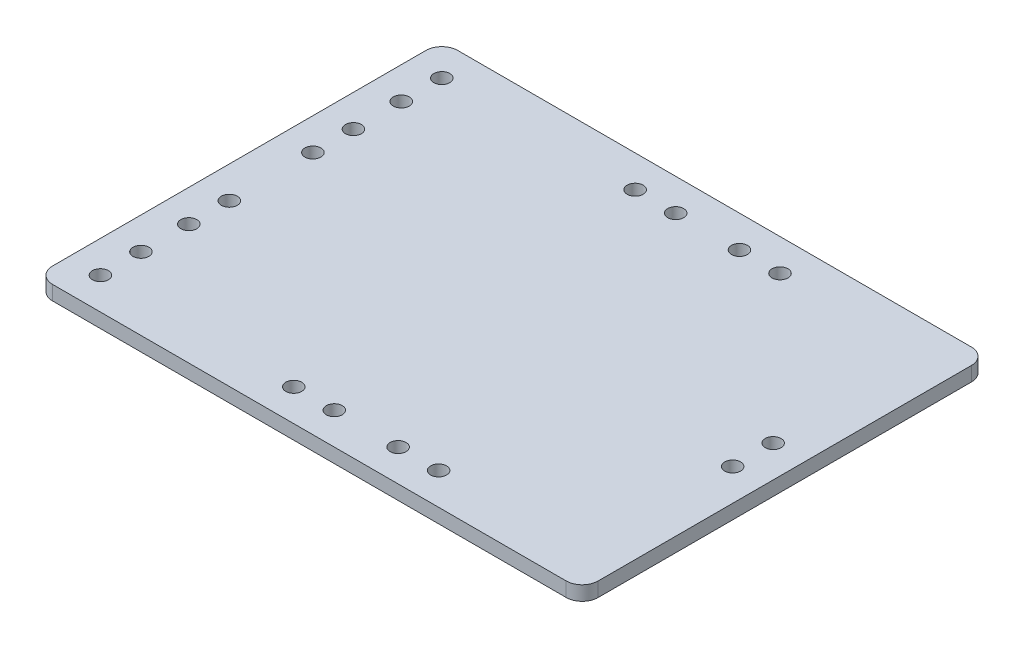
from build123d import *

# Parameters (mm, degrees)
ESBO_O1_W                = 34.2
ESBO_O1_H                = 25.4
RESSALTO_EXTRUS_O1_DEPTH = 0.45
ESBO_O2_R                = 0.5
CORTE_EXTRUS_O1_DEPTH    = 22.319240137
FILETE1_R                = 1


with BuildPart() as part:
    # Esboço1 → Ressalto-extrusão1 (new, symmetric)
    with BuildSketch(Plane(origin=(0, 0, 0), x_dir=(1, 0, 0), z_dir=(0, 1, 0))):
        Rectangle(ESBO_O1_W, ESBO_O1_H)
    extrude(amount=RESSALTO_EXTRUS_O1_DEPTH, both=True)

    # Esboço2 → Corte-extrusão1 (cut, through all)
    with BuildSketch(Plane(origin=(0, 0.45, 0), x_dir=(1, 0, 0), z_dir=(0, 1, 0))):
        with Locations(Location((15.1, 1.27, 0), (0, 0, 270))):
            Circle(ESBO_O2_R)
        with Locations(Location((15.1, -1.27, 0), (0, 0, 270))):
            Circle(ESBO_O2_R)
        with Locations(Location((-2.98, 10.7, 0), (0, 0, 270))):
            Circle(ESBO_O2_R)
        with Locations(Location((-0.44, 10.7, 0), (0, 0, 270))):
            Circle(ESBO_O2_R)
        with Locations(Location((3.56, 10.7, 0), (0, 0, 270))):
            Circle(ESBO_O2_R)
        with Locations(Location((6.1, 10.7, 0), (0, 0, 270))):
            Circle(ESBO_O2_R)
        with Locations(Location((-15.1, 2.62, 0), (0, 0, 270))):
            Circle(ESBO_O2_R)
        with Locations(Location((-15.1, 5.16, 0), (0, 0, 270))):
            Circle(ESBO_O2_R)
        with Locations(Location((-15.1, 8.16, 0), (0, 0, 270))):
            Circle(ESBO_O2_R)
        with Locations(Location((-15.1, 10.7, 0), (0, 0, 270))):
            Circle(ESBO_O2_R)
        with Locations(Location((6.1, -10.7, 0), (0, 0, 90))):
            Circle(ESBO_O2_R)
        with Locations(Location((3.56, -10.7, 0), (0, 0, 90))):
            Circle(ESBO_O2_R)
        with Locations(Location((-0.44, -10.7, 0), (0, 0, 90))):
            Circle(ESBO_O2_R)
        with Locations(Location((-2.98, -10.7, 0), (0, 0, 90))):
            Circle(ESBO_O2_R)
        with Locations(Location((-15.1, -10.7, 0), (0, 0, 90))):
            Circle(ESBO_O2_R)
        with Locations(Location((-15.1, -8.16, 0), (0, 0, 90))):
            Circle(ESBO_O2_R)
        with Locations(Location((-15.1, -5.16, 0), (0, 0, 90))):
            Circle(ESBO_O2_R)
        with Locations(Location((-15.1, -2.62, 0), (0, 0, 90))):
            Circle(ESBO_O2_R)
    extrude(amount=-CORTE_EXTRUS_O1_DEPTH, mode=Mode.SUBTRACT)

    # Filete1
    filete1_edges = [part.edges().sort_by_distance(p)[0] for p in [
        (-17.1, 0, -12.7),
        (17.1, 0, -12.7),
        (17.1, 0, 12.7),
        (-17.1, 0, 12.7),
    ]]
    fillet(filete1_edges, radius=FILETE1_R)


solid = part.part
